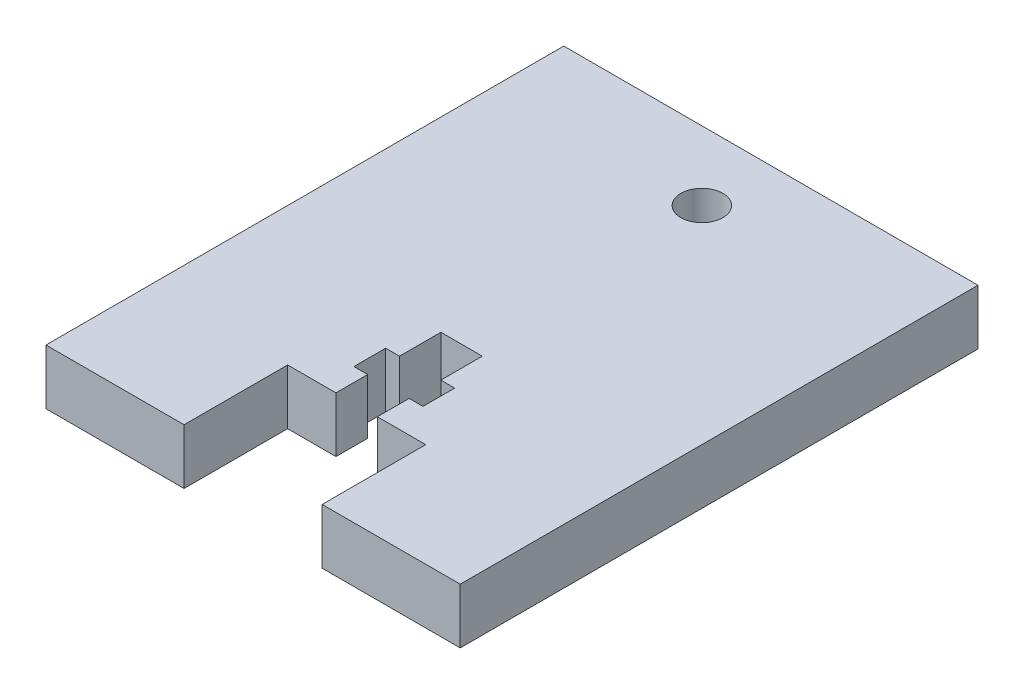
from build123d import *

# Parameters (mm, degrees)
SKETCH1_R           = 3.05
BOSS_EXTRUDE1_DEPTH = 8


with BuildPart() as part:
    # Sketch1 → Boss-Extrude1 (new body)
    with BuildSketch(Plane(origin=(0, 0, 0), x_dir=(1, 0, 0), z_dir=(0, 1, 0))):
        Polygon((-10, -37), (-10, -22), (-3, -22), (-3, -17.4), (-5, -17.4), (-5, -12.8), (-3, -12.8), (-3, -6.8), (3, -6.8), (3, -12.8), (5, -12.8), (5, -17.4), (3, -17.4), (3, -22), (10, -22), (10, -37), (30, -37), (30, 38), (-30, 38), (-30, -37), align=None)
        with Locations(Location((0, 28, 0), (0, 0, 270))):
            Circle(SKETCH1_R, mode=Mode.SUBTRACT)
    extrude(amount=BOSS_EXTRUDE1_DEPTH)


solid = part.part
